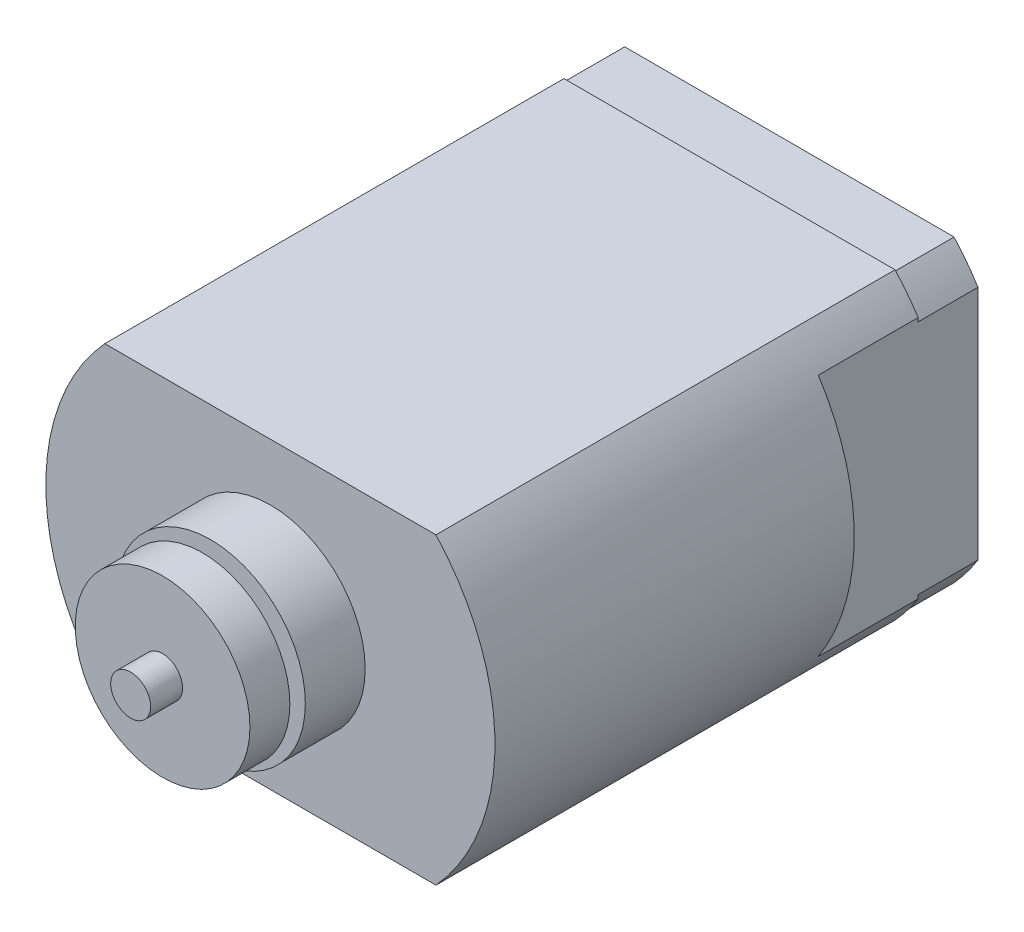
from build123d import *

# Parameters (mm, degrees)
EXTRUDE_1_DEPTH     = 26
SKETCH_2_R          = 4.75
EXTRUDE_2_DEPTH     = 3
SKETCH_3_R          = 1
EXTRUDE_3_DEPTH     = 4
SKETCH_4_R          = 4.375
T20X0_4_DEPTH       = 2
CUT_EXTRUDE_1_DEPTH = 3
SKETCH_6_R          = 3.135
EXTRUDE_5_DEPTH     = 2.5
SKETCH_7_R          = 1.25
CUT_EXTRUDE_2_DEPTH = 1
SKETCH_8_W          = 1.8
SKETCH_8_H          = 15.2
CUT_EXTRUDE_3_DEPTH = 8


with BuildPart() as part:
    # 草图1 → 凸台-拉伸1 (new body)
    with BuildSketch(Plane.XY):
        with BuildLine():
            Line((-8.294727241, 7.6), (8.294727241, 7.6))
            ThreePointArc((8.294727241, 7.6), (11.25, 0), (8.294727241, -7.6))
            Line((8.294727241, -7.6), (-8.294727241, -7.6))
            ThreePointArc((-8.294727241, -7.6), (-11.25, 0), (-8.294727241, 7.6))
        make_face()
    extrude(amount=EXTRUDE_1_DEPTH)

    # 草图2 → 凸台-拉伸2 (add)
    with BuildSketch(Plane.XY.offset(26)):
        Circle(SKETCH_2_R)
    extrude(amount=EXTRUDE_2_DEPTH)

    # 草图3 → 凸台-拉伸3 (add)
    with BuildSketch(Plane.XY.offset(29)):
        Circle(SKETCH_3_R)
    extrude(amount=EXTRUDE_3_DEPTH)

    # 草图4 → T20x0.4 (add)
    with BuildSketch(Plane.XY.offset(31.4)):
        Circle(SKETCH_4_R)
    extrude(amount=-T20X0_4_DEPTH)

    # 草图5 → 切除-拉伸1 (cut)
    with BuildSketch(Plane(origin=(0, 0, 0), x_dir=(-1, 0, 0), z_dir=(0, 0, -1))):
        with BuildLine():
            Line((8.294727241, -7.6), (-8.294727241, -7.6))
            ThreePointArc((-8.294727241, -7.6), (-11.25, 0), (-8.294727241, 7.6))
            Line((-8.294727241, 7.6), (8.294727241, 7.6))
            ThreePointArc((8.294727241, 7.6), (11.25, 0), (8.294727241, -7.6))
        make_face()
        with BuildLine():
            Line((8.250606038, 7.5), (-8.250606038, 7.5))
            ThreePointArc((-8.250606038, 7.5), (-11.15, 0), (-8.250606038, -7.5))
            Line((-8.250606038, -7.5), (8.250606038, -7.5))
            ThreePointArc((8.250606038, -7.5), (11.15, 0), (8.250606038, 7.5))
        make_face(mode=Mode.SUBTRACT)
    extrude(amount=-CUT_EXTRUDE_1_DEPTH, mode=Mode.SUBTRACT)

    # 草图6 → 凸台-拉伸5 (add)
    with BuildSketch(Plane(origin=(0, 0, 0), x_dir=(-1, 0, 0), z_dir=(0, 0, -1))):
        Circle(SKETCH_6_R)
    extrude(amount=EXTRUDE_5_DEPTH)

    # 草图7 → 切除-拉伸2 (cut)
    with BuildSketch(Plane(origin=(0, 0, -2.5), x_dir=(-1, 0, 0), z_dir=(0, 0, -1))):
        Circle(SKETCH_7_R)
    extrude(amount=-CUT_EXTRUDE_2_DEPTH, mode=Mode.SUBTRACT)

    # 草图8 → 切除-拉伸3 (cut)
    with BuildSketch(Plane(origin=(0, 0, 0), x_dir=(-1, 0, 0), z_dir=(0, 0, -1))):
        with Locations((-10.35, 0)):
            Rectangle(SKETCH_8_W, SKETCH_8_H)
    extrude(amount=-CUT_EXTRUDE_3_DEPTH, mode=Mode.SUBTRACT)


solid = part.part
